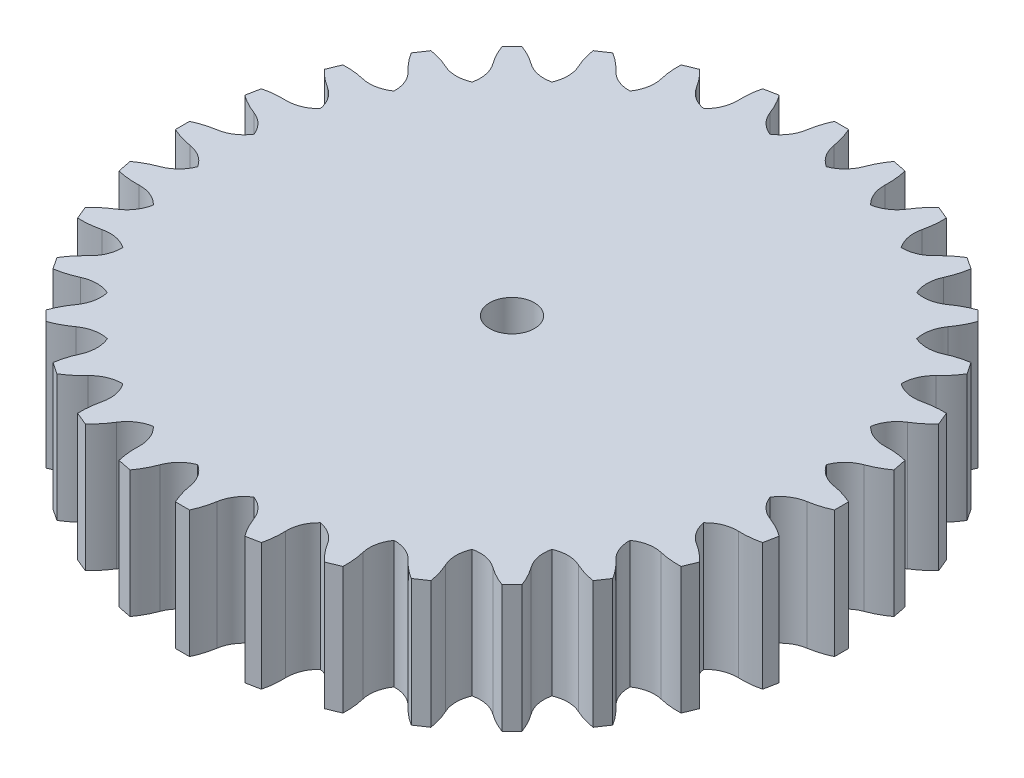
from build123d import *

# Parameters (mm, degrees)
BOSS_EXTRUDE1_DEPTH = 9
CIRPATTERN2_COUNT   = 32
BOSS_EXTRUDE3_DEPTH = 9


with BuildPart() as part:
    # Sketch1 → Boss-Extrude1 (new body)
    with BuildSketch(Plane(origin=(0, 0, 0), x_dir=(1, 0, 0), z_dir=(0, 1, 0))):
        with BuildLine():
            Line((0.5, 23.34727422), (-0.5, 23.34727422))
            ThreePointArc((-0.5, 23.34727422), (-0.952778657, 21.881070663), (-1, 20.34727422))
            Line((-1, 20.34727422), (1, 20.34727422))
            ThreePointArc((1, 20.34727422), (0.952778657, 21.881070663), (0.5, 23.34727422))
        make_face()
        with BuildLine():
            Line((0, 21.84727422), (0.9583076, 21.84727422))
            ThreePointArc((0.9583076, 21.84727422), (1.309159367, 20.947832403), (2, 20.273420239))
            Line((2, 20.273420239), (-2, 20.273420239))
            ThreePointArc((-2, 20.273420239), (-1.309159367, 20.947832403), (-0.9583076, 21.84727422))
            Line((-0.9583076, 21.84727422), (0, 21.84727422))
        make_face()
    boss_extrude1 = extrude(amount=BOSS_EXTRUDE1_DEPTH)

    # CirPattern2: Boss-Extrude1 ×32 about axis
    cirpattern2_axis = Axis((0, 0, 0), (0, 1, 0))
    for i in range(1, CIRPATTERN2_COUNT):
        add(boss_extrude1.rotate(cirpattern2_axis, i * 360 / CIRPATTERN2_COUNT))

    # Sketch1<5> → Boss-Extrude3 (add)
    with BuildSketch(Plane(origin=(0, 0, 0), x_dir=(1, 0, 0), z_dir=(0, 1, 0))):
        with BuildLine():
            ThreePointArc((20.371832716, 0), (15.095615814, 13.679691202), (2, 20.273420239))
            Line((2, 20.273420239), (-2, 20.273420239))
            ThreePointArc((-2, 20.273420239), (-13.679691202, -15.095615814), (20.371832716, 0))
        make_face()
        with BuildLine():
            ThreePointArc((0.724568837, -1.4125), (0.372701288, -1.543129936), (0, -1.5875))
            ThreePointArc((0, -1.5875), (-0.372701288, -1.543129936), (-0.724568837, -1.4125))
            ThreePointArc((-0.724568837, -1.4125), (-1.543129936, 0.372701288), (0, 1.5875))
            ThreePointArc((0, 1.5875), (1.122532015, 1.122532015), (1.5875, 0))
            ThreePointArc((1.5875, 0), (1.35469725, -0.827618034), (0.724568837, -1.4125))
        make_face(mode=Mode.SUBTRACT)
    extrude(amount=BOSS_EXTRUDE3_DEPTH)


solid = part.part
